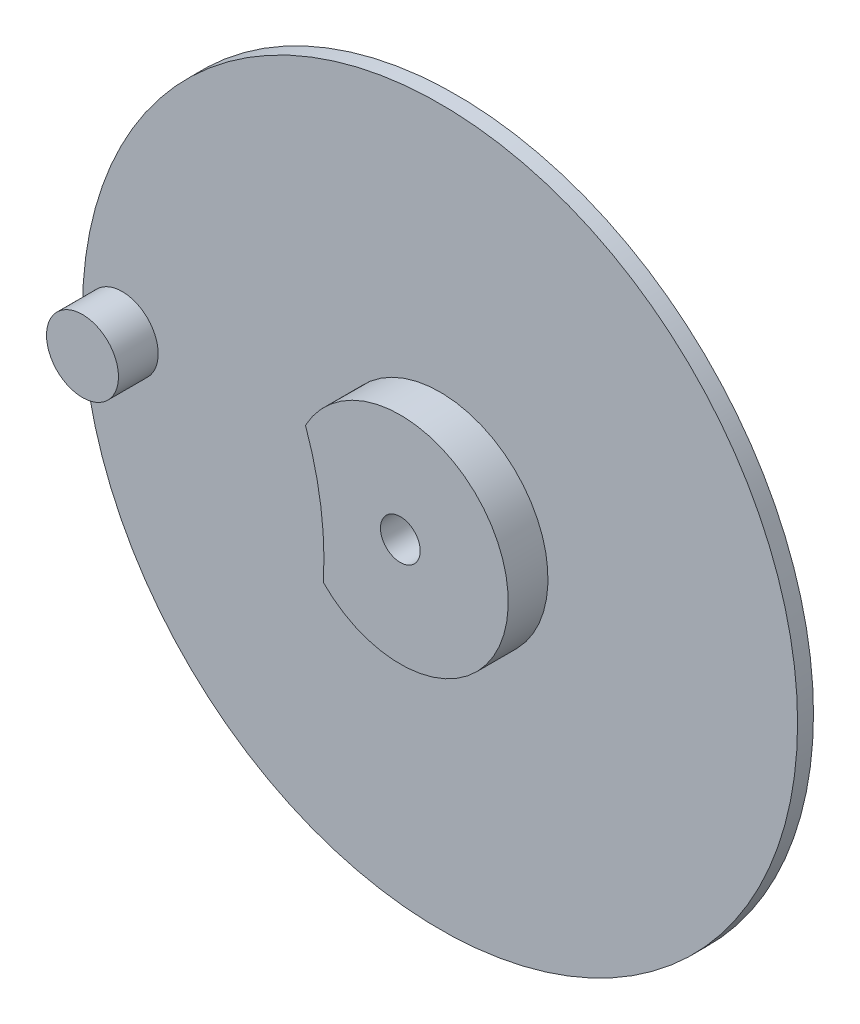
from build123d import *

# Parameters (mm, degrees)
SKETCH_1_R      = 3.5775
SKETCH_1_R_2    = 0.19875
EXTRUDE_2_DEPTH = 0.159
EXTRUDE_START   = 0.3975
SKETCH_1_6_R    = 0.19875
SKETCH_1_6_R_2  = 0.36
EXTRUDE_3_DEPTH = 0.3975
SCALE_3_SCALE   = 25


with BuildPart() as part:
    # 草图1 → 凸台-拉伸2 (new body)
    with BuildSketch(Plane.XY):
        Circle(SKETCH_1_R)
        Circle(SKETCH_1_R_2, mode=Mode.SUBTRACT)
    extrude(amount=-EXTRUDE_2_DEPTH)

    # 草图1<6> → 凸台-拉伸3 (add)
    # profile 1 of 2: a face of its own
    with BuildSketch(Plane.XY.offset(EXTRUDE_START)):
        with BuildLine():
            ThreePointArc((-0.948975285, 0.515602472), (-0.794802322, -0.111488288), (-0.770493853, -0.756795363))
            ThreePointArc((-0.770493853, -0.756795363), (1.069529145, 0.150024692), (-0.948975285, 0.515602472))
        make_face()
        Circle(SKETCH_1_6_R, mode=Mode.SUBTRACT)
    # profile 2 of 2: a face of its own
    with BuildSketch(Plane.XY.offset(EXTRUDE_START)):
        with Locations((-3.18, 0)):
            Circle(SKETCH_1_6_R_2)
    extrude(amount=-EXTRUDE_3_DEPTH)


with BuildPart() as part_1:
    # 缩放比例3: scaled about (-0.054347158, 0.00157736, -0.027262254)
    add(part.part.scale(SCALE_3_SCALE).moved(Location((1.304331792, -0.03785664, 0.654294096))))


solid = part_1.part
